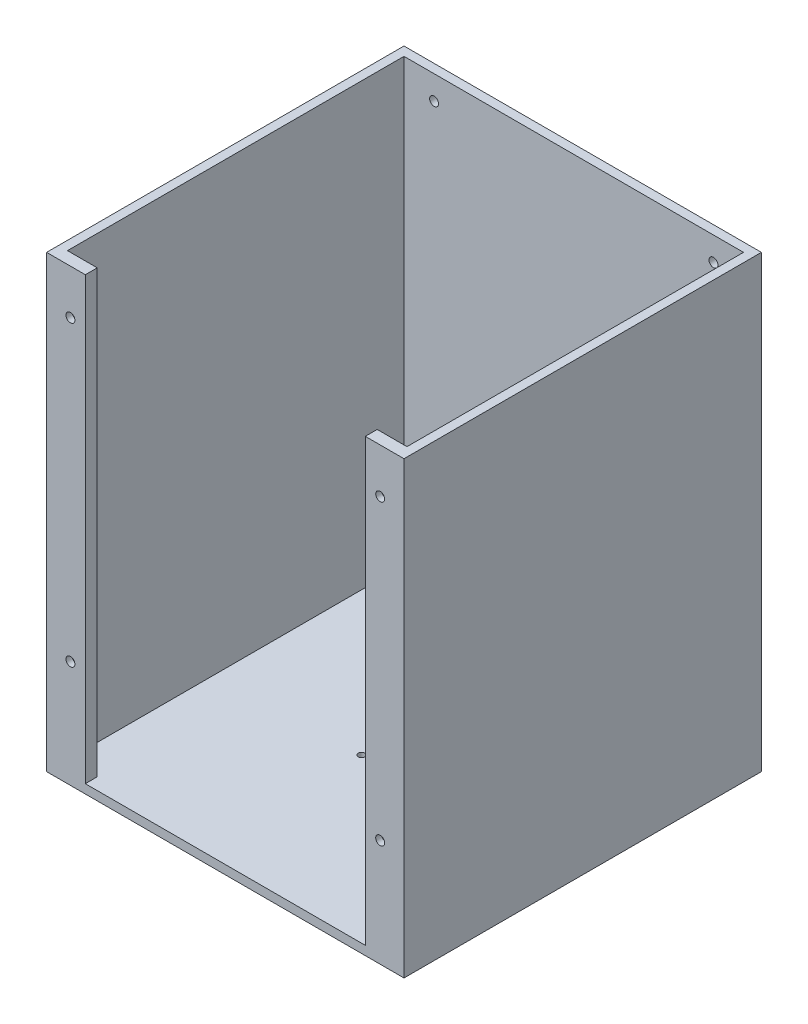
from build123d import *

# Parameters (mm, degrees)
SKETCH1_W                = 120
SKETCH1_H                = 120
MAIN_BODY_DEPTH          = 151
SKETCH11_W               = 114
SKETCH11_H               = 117
HOLLOW_DEPTH             = 148
SKETCH12_W               = 4
SKETCH12_H               = 148
BOSS_EXTRUDE1_DEPTH      = 10
SKETCH13_W               = 4
SKETCH13_H               = 148
BOSS_EXTRUDE2_DEPTH      = 10
LED_MOUNTING_HOLES_REACH = 175.208
SKETCH14_R               = 1.1
SKETCH15_R               = 1.5
LED_POSITION_DEPTH       = 1
BOLT_HOLE_1_REACH        = 203.993
SKETCH16_R               = 1.5
LPATTERN1_COUNT          = 2
LPATTERN1_PITCH          = 93.8
CUT_EXTRUDE5_DEPTH       = 2
SKETCH20_R               = 1.5
CUT_EXTRUDE6_DEPTH       = 10
SKETCH21_R               = 1.5
BOLT_HOLE1_DEPTH         = 10
NUT_HOLE1_DEPTH          = 2
NUT_HOLE3_DEPTH          = 2
SKETCH33_R               = 1.5
BOLT_HOLE3_DEPTH         = 12
NUT_HOLE4_DEPTH          = 2
SKETCH35_R               = 1.5
CUT_EXTRUDE16_DEPTH      = 12


with BuildPart() as part:
    # Sketch1 → Main-Body (new body)
    with BuildSketch(Plane(origin=(0, 0, 0), x_dir=(1, 0, 0), z_dir=(0, 1, 0))):
        Rectangle(SKETCH1_W, SKETCH1_H)
    extrude(amount=MAIN_BODY_DEPTH)

    # Sketch11 → Hollow (cut)
    with BuildSketch(Plane(origin=(0, 151, 0), x_dir=(1, 0, 0), z_dir=(0, 1, 0))):
        with Locations((0, -1.5)):
            Rectangle(SKETCH11_W, SKETCH11_H)
    extrude(amount=-HOLLOW_DEPTH, mode=Mode.SUBTRACT)

    # Sketch12 → Boss-Extrude1 (add)
    with BuildSketch(Plane.ZY.offset(-57)):
        with Locations((58, 77)):
            Rectangle(SKETCH12_W, SKETCH12_H)
    extrude(amount=BOSS_EXTRUDE1_DEPTH)

    # Sketch13 → Boss-Extrude2 (add)
    with BuildSketch(Plane(origin=(-57, 0, 0), x_dir=(0, 0, -1), z_dir=(1, 0, 0))):
        with Locations((-58, 77)):
            Rectangle(SKETCH13_W, SKETCH13_H)
    extrude(amount=BOSS_EXTRUDE2_DEPTH)

    # Sketch14 → LED-Mounting-Holes (cut, up to next)
    with BuildSketch(Plane(origin=(0, 0, 0), x_dir=(0, 0, 1), z_dir=(0, -1, 0)), mode=Mode.PRIVATE) as led_mounting_holes_sk1:
        with Locations(Location((-2.225, 9, 0), (0, 0, 180))):
            Circle(SKETCH14_R)
    led_mounting_holes_tool1 = extrude(led_mounting_holes_sk1.sketch, amount=-LED_MOUNTING_HOLES_REACH, mode=Mode.PRIVATE) & part.part
    # Sketch14 → LED-Mounting-Holes (cut, up to next)
    with BuildSketch(Plane(origin=(0, 0, 0), x_dir=(0, 0, 1), z_dir=(0, -1, 0)), mode=Mode.PRIVATE) as led_mounting_holes_sk2:
        with Locations(Location((5.275, 9, 0), (0, 0, 180))):
            Circle(SKETCH14_R)
    led_mounting_holes_tool2 = extrude(led_mounting_holes_sk2.sketch, amount=-LED_MOUNTING_HOLES_REACH, mode=Mode.PRIVATE) & part.part
    # Sketch14 → LED-Mounting-Holes (cut, up to next)
    with BuildSketch(Plane(origin=(0, 0, 0), x_dir=(0, 0, 1), z_dir=(0, -1, 0)), mode=Mode.PRIVATE) as led_mounting_holes_sk3:
        with Locations(Location((5.275, -9, 0), (0, 0, 180))):
            Circle(SKETCH14_R)
    led_mounting_holes_tool3 = extrude(led_mounting_holes_sk3.sketch, amount=-LED_MOUNTING_HOLES_REACH, mode=Mode.PRIVATE) & part.part
    # Sketch14 → LED-Mounting-Holes (cut, up to next)
    with BuildSketch(Plane(origin=(0, 0, 0), x_dir=(0, 0, 1), z_dir=(0, -1, 0)), mode=Mode.PRIVATE) as led_mounting_holes_sk4:
        with Locations(Location((-2.225, -9, 0), (0, 0, 180))):
            Circle(SKETCH14_R)
    led_mounting_holes_tool4 = extrude(led_mounting_holes_sk4.sketch, amount=-LED_MOUNTING_HOLES_REACH, mode=Mode.PRIVATE) & part.part
    add(led_mounting_holes_tool1.solids().sort_by_distance((-9, 0, -2.225))[0], mode=Mode.SUBTRACT)
    add(led_mounting_holes_tool2.solids().sort_by_distance((-9, 0, 5.275))[0], mode=Mode.SUBTRACT)
    add(led_mounting_holes_tool3.solids().sort_by_distance((9, 0, 5.275))[0], mode=Mode.SUBTRACT)
    add(led_mounting_holes_tool4.solids().sort_by_distance((9, 0, -2.225))[0], mode=Mode.SUBTRACT)

    # Sketch15 → LED-Position (cut)
    with BuildSketch(Plane(origin=(0, 3, 0), x_dir=(1, 0, 0), z_dir=(0, 1, 0))):
        with Locations(Location((0, -0.05, 0), (0, 0, 270))):
            Circle(SKETCH15_R)
    extrude(amount=-LED_POSITION_DEPTH, mode=Mode.SUBTRACT)

    # Sketch16 → Bolt-Hole-1 (cut, up to next)
    with BuildSketch(Plane(origin=(0, 0, -60), x_dir=(-1, 0, 0), z_dir=(0, 0, -1)), mode=Mode.PRIVATE) as bolt_hole_1_sk1:
        with Locations((-46.9, 143)):
            Circle(SKETCH16_R)
    bolt_hole_1_tool1 = extrude(bolt_hole_1_sk1.sketch, amount=-BOLT_HOLE_1_REACH, mode=Mode.PRIVATE) & part.part
    bolt_hole_1 = bolt_hole_1_tool1.solids().sort_by_distance((46.9, 143, -60))[0]
    add(bolt_hole_1, mode=Mode.SUBTRACT)

    # LPattern1: Bolt-Hole-1 ×2
    with Locations(*[(-i * LPATTERN1_PITCH, 0, 0) for i in range(1, LPATTERN1_COUNT)]):
        add(bolt_hole_1, mode=Mode.SUBTRACT)

    # Sketch18 → Cut-Extrude5 (cut)
    with BuildSketch(Plane(origin=(0, 0, 56), x_dir=(-1, 0, 0), z_dir=(0, 0, -1))):
        Polygon((55.2, 136), (53.6, 138.771281292), (50.4, 138.771281292), (48.8, 136), (50.4, 133.228718708), (53.6, 133.228718708), align=None)
    extrude(amount=-CUT_EXTRUDE5_DEPTH, mode=Mode.SUBTRACT)

    # Sketch20 → Cut-Extrude6 (cut)
    with BuildSketch(Plane(origin=(0, 0, 58), x_dir=(-1, 0, 0), z_dir=(0, 0, -1))):
        with Locations((52, 136)):
            Circle(SKETCH20_R)
    extrude(amount=-CUT_EXTRUDE6_DEPTH, mode=Mode.SUBTRACT)

    # Sketch21 → Bolt-Hole1 (cut)
    with BuildSketch(Plane(origin=(0, 0, 56), x_dir=(-1, 0, 0), z_dir=(0, 0, -1))):
        with Locations(Location((52, 36, 0), (0, 0, 90))):
            Circle(SKETCH21_R)
    extrude(amount=-BOLT_HOLE1_DEPTH, mode=Mode.SUBTRACT)

    # Sketch29 → Nut-hole1 (cut)
    with BuildSketch(Plane(origin=(0, 0, 56), x_dir=(-1, 0, 0), z_dir=(0, 0, -1))):
        Polygon((55.2, 36), (53.6, 38.771281292), (50.4, 38.771281292), (48.8, 36), (50.4, 33.228718708), (53.6, 33.228718708), align=None)
    extrude(amount=-NUT_HOLE1_DEPTH, mode=Mode.SUBTRACT)

    # Sketch32 → Nut-Hole3 (cut)
    with BuildSketch(Plane(origin=(0, 0, 56), x_dir=(-1, 0, 0), z_dir=(0, 0, -1))):
        Polygon((-48.8, 136), (-50.4, 138.771281292), (-53.6, 138.771281292), (-55.2, 136), (-53.6, 133.228718708), (-50.4, 133.228718708), align=None)
    extrude(amount=-NUT_HOLE3_DEPTH, mode=Mode.SUBTRACT)

    # Sketch33 → Bolt-Hole3 (cut)
    with BuildSketch(Plane(origin=(0, 0, 56), x_dir=(-1, 0, 0), z_dir=(0, 0, -1))):
        with Locations((-52, 136)):
            Circle(SKETCH33_R)
    extrude(amount=-BOLT_HOLE3_DEPTH, mode=Mode.SUBTRACT)

    # Sketch34 → Nut-hole4 (cut)
    with BuildSketch(Plane(origin=(0, 0, 56), x_dir=(-1, 0, 0), z_dir=(0, 0, -1))):
        Polygon((-48.8, 36), (-50.4, 38.771281292), (-53.6, 38.771281292), (-55.2, 36), (-53.6, 33.228718708), (-50.4, 33.228718708), align=None)
    extrude(amount=-NUT_HOLE4_DEPTH, mode=Mode.SUBTRACT)

    # Sketch35 → Cut-Extrude16 (cut)
    with BuildSketch(Plane(origin=(0, 0, 56), x_dir=(-1, 0, 0), z_dir=(0, 0, -1))):
        with Locations((-52, 36)):
            Circle(SKETCH35_R)
    extrude(amount=-CUT_EXTRUDE16_DEPTH, mode=Mode.SUBTRACT)


solid = part.part
